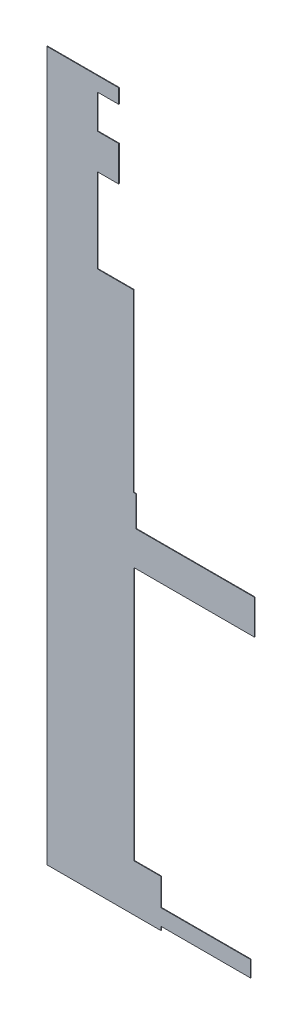
from build123d import *

# Parameters (mm, degrees)
SKETCH_1_W      = 15.2
SKETCH_1_H      = 25
SKETCH_1_W_2    = 15.9
SKETCH_1_W_3    = 60
SKETCH_1_H_2    = 55.8
SKETCH_1_H_3    = 56.6
SKETCH_1_H_4    = 59.4
SKETCH_1_W_4    = 147.9
SKETCH_1_H_5    = 26.5
SKETCH_1_H_6    = 78.6
SKETCH_1_H_7    = 80.6
SKETCH_1_H_8    = 81.1
SKETCH_1_W_5    = 59.5
SKETCH_1_H_9    = 83.5
SKETCH_1_H_10   = 84.1
SKETCH_1_H_11   = 84.6
SKETCH_1_H_12   = 84.7
SKETCH_1_H_13   = 103
SKETCH_1_H_14   = 103.2
SKETCH_1_H_15   = 105.1
SKETCH_1_H_16   = 111.3
SKETCH_1_H_17   = 127.2
SKETCH_1_H_18   = 130
EXTRUDE_1_DEPTH = 1


with BuildPart() as part:
    # 草图1 → 拉伸1 (new body)
    with BuildSketch(Plane.XY.offset(42)):
        with Locations((91, -1104.8)):
            Rectangle(SKETCH_1_W, SKETCH_1_H)
        with Locations((106.55, -1104.8)):
            Rectangle(SKETCH_1_W_2, SKETCH_1_H)
        with Locations((113.4, -865.7)):
            Rectangle(SKETCH_1_W_3, SKETCH_1_H_2)
        with Locations((30, -811.2)):
            Rectangle(SKETCH_1_W_3, SKETCH_1_H_3)
        with Locations((30, -306.2)):
            Rectangle(SKETCH_1_W_3, SKETCH_1_H_4)
        with Locations((262.05, -1150.35)):
            Rectangle(SKETCH_1_W_4, SKETCH_1_H_5)
        with Locations((30, -1130.5)):
            Rectangle(SKETCH_1_W_3, SKETCH_1_H_6)
        with Locations((30, -40.3)):
            Rectangle(SKETCH_1_W_3, SKETCH_1_H_7)
        with Locations((113.4, -713.75)):
            Rectangle(SKETCH_1_W_3, SKETCH_1_H_8)
        with Locations((113.15, -421.25)):
            Rectangle(SKETCH_1_W_5, SKETCH_1_H_9)
        with Locations((30, -1049.45)):
            Rectangle(SKETCH_1_W_3, SKETCH_1_H_9)
        with Locations((113.4, -796.05)):
            Rectangle(SKETCH_1_W_3, SKETCH_1_H_9)
        with Locations((30, -965.65)):
            Rectangle(SKETCH_1_W_3, SKETCH_1_H_10)
        with Locations((30, -881.55)):
            Rectangle(SKETCH_1_W_3, SKETCH_1_H_10)
        with Locations((30, -234.2)):
            Rectangle(SKETCH_1_W_3, SKETCH_1_H_11)
        with Locations((30, -378.25)):
            Rectangle(SKETCH_1_W_3, SKETCH_1_H_12)
        with Locations((113.4, -935.95)):
            Rectangle(SKETCH_1_W_3, SKETCH_1_H_12)
        with Locations((113.15, -328)):
            Rectangle(SKETCH_1_W_5, SKETCH_1_H_13)
        with Locations((113.15, -514.6)):
            Rectangle(SKETCH_1_W_5, SKETCH_1_H_14)
        with Locations((30, -730.35)):
            Rectangle(SKETCH_1_W_3, SKETCH_1_H_15)
        with Locations((30, -136.25)):
            Rectangle(SKETCH_1_W_3, SKETCH_1_H_16)
        Polygon((83.4, -978.3), (143.4, -978.3), (143.4, -1092.3), (114.5, -1092.3), (98.6, -1092.3), (83.4, -1092.3), align=None)
        with Locations((30, -614.2)):
            Rectangle(SKETCH_1_W_3, SKETCH_1_H_17)
        with Locations((30, -485.6)):
            Rectangle(SKETCH_1_W_3, SKETCH_1_H_18)
        Polygon((188.1, -1117.3), (188.1, -1092.3), (166.2, -1092.3), (143.4, -1092.3), (114.5, -1092.3), (114.5, -1117.3), (98.6, -1117.3), (83.4, -1117.3), (83.4, -1092.3), (83.4, -978.3), (83.4, -893.6), (83.4, -837.8), (83.4, -754.3), (83.4, -673.2), (143.4, -673.2), (342.5, -673.2), (342.5, -616.2), (192.5, -616.2), (146.7, -616.2), (146.7, -566.2), (142.9, -566.2), (83.4, -566.2), (83.4, -463), (83.4, -379.5), (83.4, -276.5), (83.4, -137.6), (118.4, -137.6), (118.4, -79.7), (83.4, -79.7), (83.4, -23.7), (118.4, -23.7), (118.4, 0), (60, 0), (60, -80.6), (60, -191.9), (60, -276.5), (60, -335.9), (60, -420.6), (60, -550.6), (60, -677.8), (60, -782.9), (60, -839.5), (60, -923.6), (60, -1007.7), (60, -1091.2), (60, -1169.8), (188.1, -1169.8), (188.1, -1163.6), (188.1, -1137.1), align=None)
    extrude(amount=-EXTRUDE_1_DEPTH)


solid = part.part
